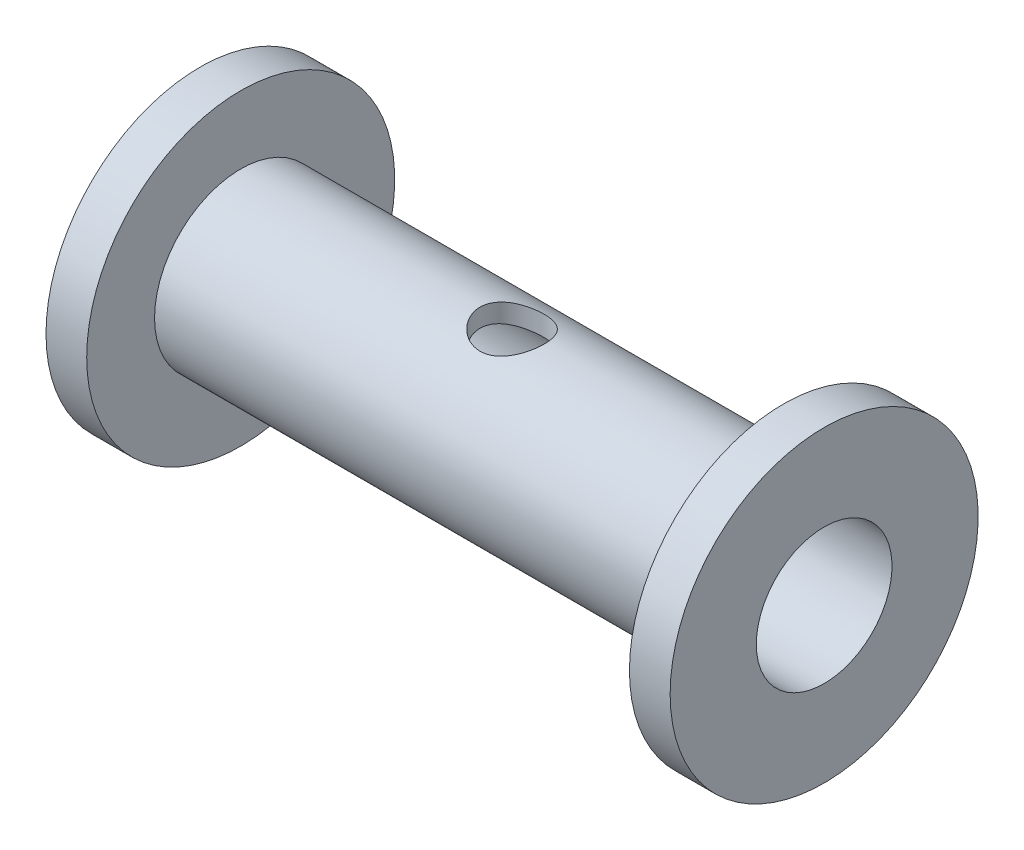
from build123d import *

# Parameters (mm, degrees)
SKETCH2_R          = 1.5
CUT_EXTRUDE1_DEPTH = 18.809967157


with BuildPart() as part:
    # Sketch1 → Revolve1 (revolve)
    with BuildSketch(Plane.XY):
        Polygon((14.605, 3.175), (14.605, 7.20725), (12.7, 7.20725), (12.7, 4.03225), (-12.7, 4.03225), (-12.7, 7.20725), (-14.605, 7.20725), (-14.605, 3.175), align=None)
    revolve(axis=Axis((-15.275524476, 0, 0), (1, 0, 0)))

    # Sketch2 → Cut-Extrude1 (cut, through all)
    with BuildSketch(Plane(origin=(0, 0, 0), x_dir=(1, 0, 0), z_dir=(0, 1, 0))):
        Circle(SKETCH2_R)
    extrude(amount=CUT_EXTRUDE1_DEPTH, mode=Mode.SUBTRACT)


solid = part.part
